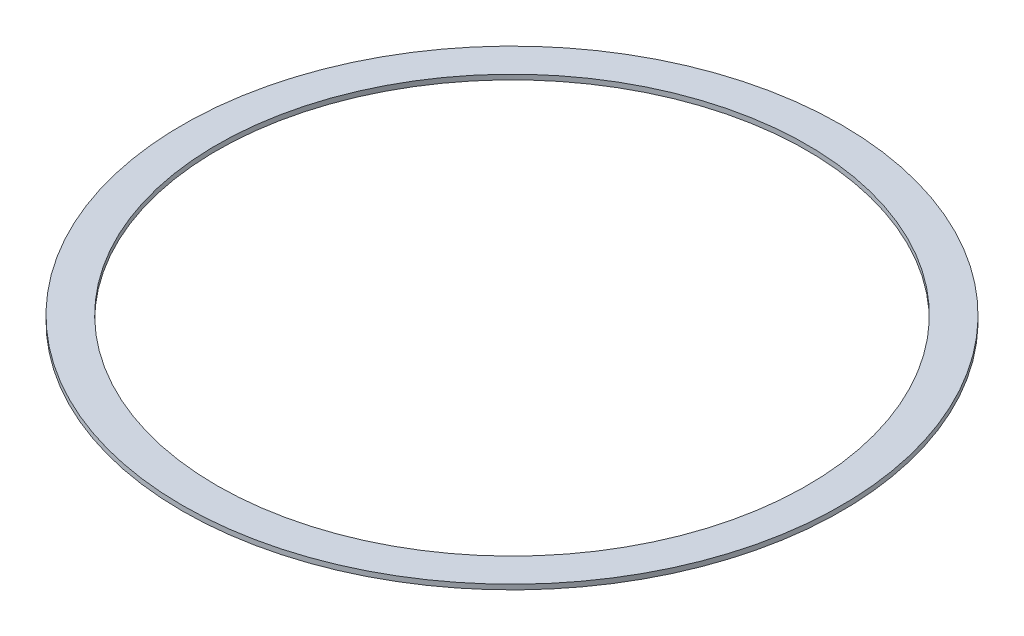
from build123d import *

# Parameters (mm, degrees)
SCHIZZO1_R                   = 67
SCHIZZO1_R_2                 = 60
ESTRUSIONE_ESTRUSIONE1_DEPTH = 0.5


with BuildPart() as part:
    # Schizzo1 → Estrusione-Estrusione1 (new, symmetric)
    with BuildSketch(Plane(origin=(0, 0, 0), x_dir=(1, 0, 0), z_dir=(0, 1, 0))):
        with Locations(Location((0, 0, 0), (0, 0, 270))):
            Circle(SCHIZZO1_R)
        with Locations(Location((0, 0, 0), (0, 0, 270))):
            Circle(SCHIZZO1_R_2, mode=Mode.SUBTRACT)
    extrude(amount=ESTRUSIONE_ESTRUSIONE1_DEPTH, both=True)


solid = part.part
